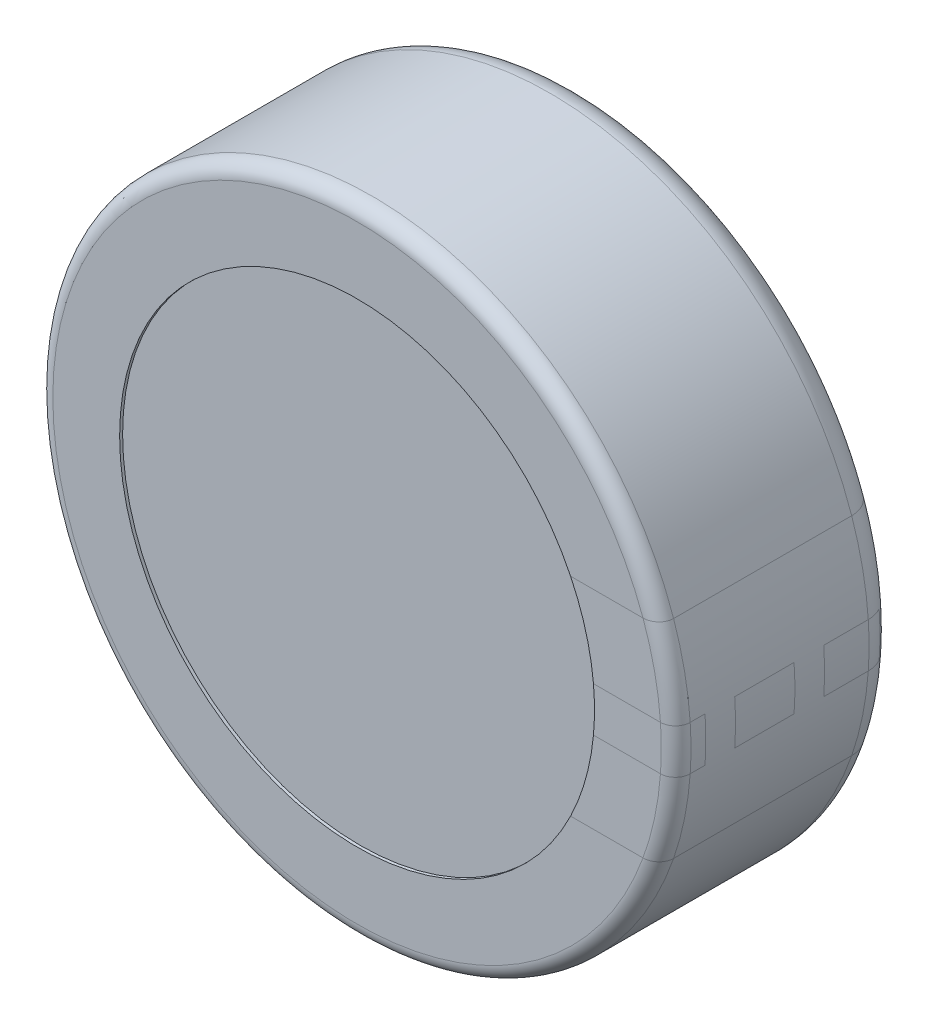
from build123d import *

# Parameters (mm, degrees)
EXTRUDE_1_DEPTH        = 0.2
FILLET_1_R             = 0.1
FILLET_1_OF_MIRROR_1_R = 0.1
SKETCH_10_R            = 1.75
SKETCH_10_W            = 5.6
SKETCH_10_H            = 3.5
EXTRUDE_2_DEPTH        = 0.1


with BuildPart() as part:
    # Эскиз1 → Повернуть1 (revolve)
    with BuildSketch(Plane(origin=(0, 0, 0), x_dir=(1, 0, 0), z_dir=(0, 1, 0))):
        with BuildLine():
            Line((0, -0.8), (-8, -0.8))
            Line((-8, -0.8), (-8, -0.5))
            ThreePointArc((-8, -0.5), (-8.146446609, -0.146446609), (-8.5, 0))
            Line((-8.5, 0), (-9.75, 0))
            ThreePointArc((-9.75, 0), (-10.457106781, -0.292893219), (-10.75, -1))
            Line((-10.75, -1), (-10.75, -7))
            ThreePointArc((-10.75, -7), (-10.603553391, -7.353553391), (-10.25, -7.5))
            Line((-10.25, -7.5), (-8, -7.5))
            Line((-8, -7.5), (-8, -7.4))
            Line((-8, -7.4), (0, -7.4))
            Line((0, -7.4), (0, -0.8))
        make_face()
    revolve(axis=Axis((0, 0, 0), (0, 0, 1)))

    # Эскиз9 → Бобышка-Вытянуть1 (add, symmetric)
    with BuildSketch(Plane(origin=(-2.5, 0, 0), x_dir=(0, 0, -1), z_dir=(1, 0, 0))):
        with BuildLine():
            Line((-0.8, 0.6), (-0.8, -0.6))
            Line((-0.8, -0.6), (1.271098616, -0.6))
            Line((1.271098616, -0.6), (1.7, -0.4))
            Line((1.7, -0.4), (3.8, -0.4))
            ThreePointArc((3.8, -0.4), (4.2, 0), (3.8, 0.4))
            Line((3.8, 0.4), (1.7, 0.4))
            Line((1.7, 0.4), (1.271098616, 0.6))
            Line((1.271098616, 0.6), (-0.8, 0.6))
        make_face()
    extrude_1 = extrude(amount=EXTRUDE_1_DEPTH, both=True)

    # Скругление1
    fillet_1_edges = [part.edges().sort_by_distance(p)[0] for p in [
        (-2.7, -0.6, -0.235549308),
        (-2.5, -0.6, 0.8),
        (-2.7, -0.5, -1.485549308),
        (-2.5, -0.6, -1.271098616),
        (-2.7, -0.4, -2.75),
        (-2.5, -0.4, -1.7),
        (-2.7, 0, -4.2),
        (-2.7, 0.4, -2.75),
        (-2.7, 0.5, -1.485549308),
        (-2.5, 0.4, -1.7),
        (-2.7, 0.6, -0.235549308),
        (-2.5, 0.6, -1.271098616),
        (-2.7, 0, 0.8),
        (-2.5, 0.6, 0.8),
        (-2.3, -0.6, -0.235549308),
        (-2.3, -0.5, -1.485549308),
        (-2.3, -0.4, -2.75),
        (-2.3, 0, -4.2),
        (-2.3, 0.4, -2.75),
        (-2.3, 0.5, -1.485549308),
        (-2.3, 0.6, -0.235549308),
        (-2.3, 0, 0.8),
    ]]
    fillet(fillet_1_edges, radius=FILLET_1_R)

    # Зеркальное отражение1: Бобышка-Вытянуть1 across plane
    add(extrude_1.mirror(Plane(origin=(0, 0, 0), x_dir=(0, 0, 1), z_dir=(1, 0, 0))))

    # Скругление1 of Зеркальное отражение1
    fillet_1_of_mirror_1_edges = [part.edges().sort_by_distance(p)[0] for p in [
        (2.7, -0.6, -0.235549308),
        (2.5, -0.6, 0.8),
        (2.7, -0.5, -1.485549308),
        (2.5, -0.6, -1.271098616),
        (2.7, -0.4, -2.75),
        (2.5, -0.4, -1.7),
        (2.7, 0, -4.2),
        (2.7, 0.4, -2.75),
        (2.7, 0.5, -1.485549308),
        (2.5, 0.4, -1.7),
        (2.7, 0.6, -0.235549308),
        (2.5, 0.6, -1.271098616),
        (2.7, 0, 0.8),
        (2.5, 0.6, 0.8),
        (2.3, -0.6, -0.235549308),
        (2.3, -0.5, -1.485549308),
        (2.3, -0.4, -2.75),
        (2.3, 0, -4.2),
        (2.3, 0.4, -2.75),
        (2.3, 0.5, -1.485549308),
        (2.3, 0.6, -0.235549308),
        (2.3, 0, 0.8),
    ]]
    fillet(fillet_1_of_mirror_1_edges, radius=FILLET_1_OF_MIRROR_1_R)

    # Эскиз10 → Бобышка-Вытянуть2 (add)
    with BuildSketch(Plane(origin=(0, 0, 0.8), x_dir=(-1, 0, 0), z_dir=(0, 0, -1))):
        with Locations((2.5, 0)):
            Circle(SKETCH_10_R)
        with Locations((-5.2, 0)):
            Rectangle(SKETCH_10_W, SKETCH_10_H)
    extrude(amount=EXTRUDE_2_DEPTH)


solid = part.part
